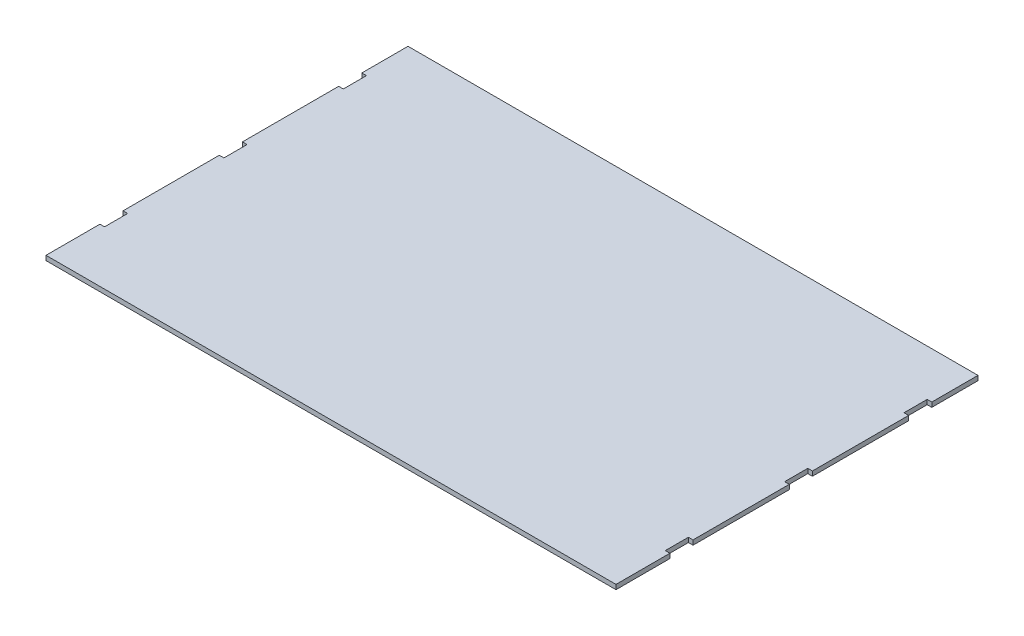
from build123d import *

# Parameters (mm, degrees)
BOSS_EXTRUDE1_DEPTH = 3


with BuildPart() as part:
    # Sketch16 → Boss-Extrude1 (new body)
    with BuildSketch(Plane(origin=(0, 0, 0), x_dir=(1, 0, 0), z_dir=(0, 1, 0))):
        Polygon((370, 205), (367, 205), (367, 190), (370, 190), (370, 127.5), (367, 127.5), (367, 112.5), (370, 112.5), (370, 50), (367, 50), (367, 35), (370, 35), (370, 0), (0, 0), (0, 35), (3, 35), (3, 50), (0, 50), (0, 112.5), (3, 112.5), (3, 127.5), (0, 127.5), (0, 190), (3, 190), (3, 205), (0, 205), (0, 235), (370, 235), align=None)
    extrude(amount=BOSS_EXTRUDE1_DEPTH)


solid = part.part
